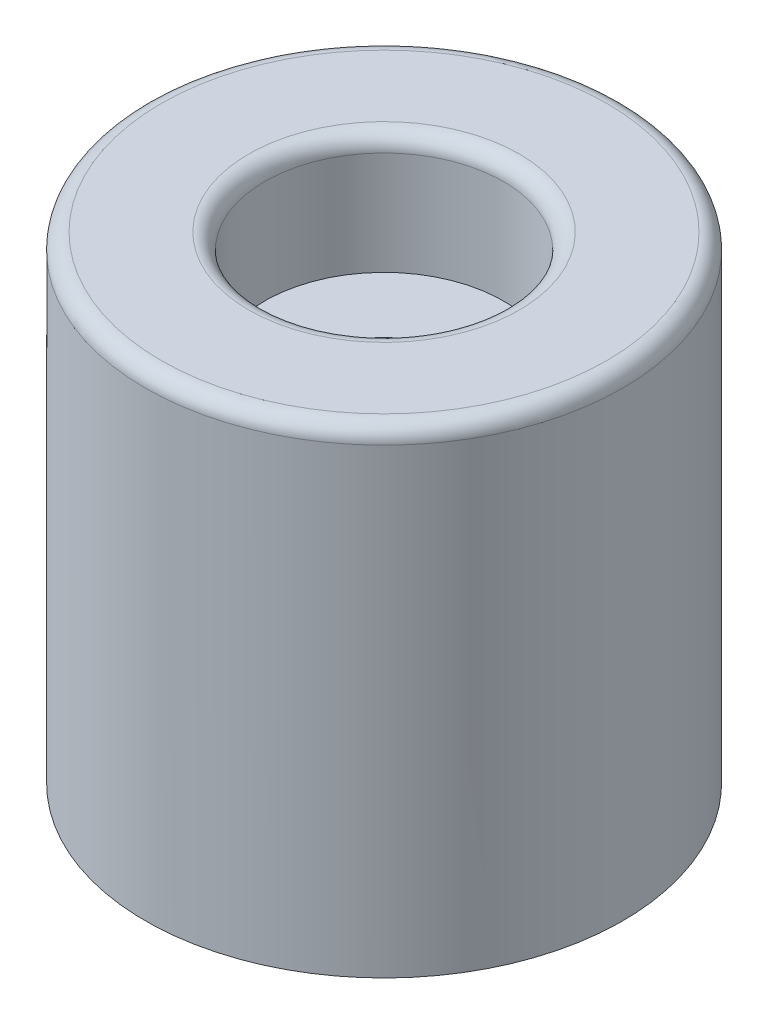
from build123d import *

# Parameters (mm, degrees)
SKETCH1_R           = 19.05
BOSS_EXTRUDE1_DEPTH = 38.1
SKETCH2_R           = 9.525
CUT_EXTRUDE1_DEPTH  = 9.525
SKETCH3_R           = 3.175
CUT_EXTRUDE2_DEPTH  = 40.272581084
FILLET1_R           = 1.27


with BuildPart() as part:
    # Sketch1 → Boss-Extrude1 (new body)
    with BuildSketch(Plane(origin=(0, 0, 0), x_dir=(1, 0, 0), z_dir=(0, 1, 0))):
        with Locations(Location((0, 0, 0), (0, 0, 90))):
            Circle(SKETCH1_R)
    extrude(amount=BOSS_EXTRUDE1_DEPTH)

    # Sketch2 → Cut-Extrude1 (cut)
    with BuildSketch(Plane(origin=(0, 38.1, 0), x_dir=(1, 0, 0), z_dir=(0, 1, 0))):
        with Locations(Location((0, 0, 0), (0, 0, 270))):
            Circle(SKETCH2_R)
    extrude(amount=-CUT_EXTRUDE1_DEPTH, mode=Mode.SUBTRACT)

    # Sketch3 → Cut-Extrude2 (cut, through all)
    with BuildSketch(Plane(origin=(0, 28.575, 0), x_dir=(1, 0, 0), z_dir=(0, 1, 0))):
        with Locations(Location((0, 0, 0), (0, 0, 270))):
            Circle(SKETCH3_R)
    extrude(amount=-CUT_EXTRUDE2_DEPTH, mode=Mode.SUBTRACT)

    # Fillet1
    fillet1_edges = [part.edges().sort_by_distance(p)[0] for p in [
        (0, 38.1, 19.05),
        (0, 38.1, -9.525),
    ]]
    fillet(fillet1_edges, radius=FILLET1_R)


solid = part.part
